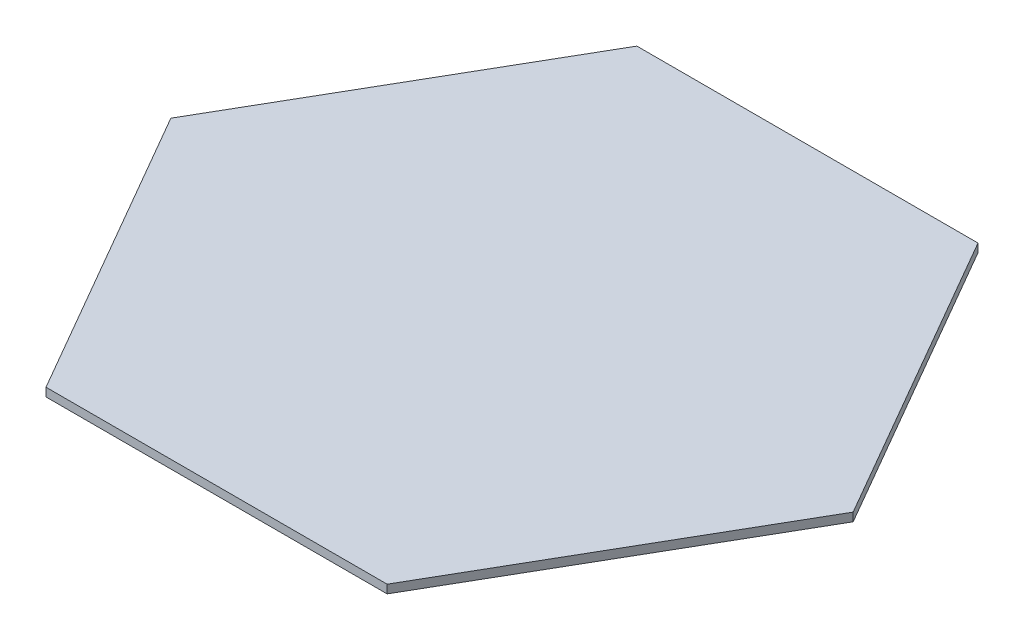
from build123d import *

# Parameters (mm, degrees)
BOSS_EXTRUDE1_DEPTH = 4


with BuildPart() as part:
    # Sketch2 → Boss-Extrude1 (new body)
    with BuildSketch(Plane(origin=(0, 0, 0), x_dir=(1, 0, 0), z_dir=(0, 1, 0))):
        Polygon((161.658075373, 0), (80.829037687, 140), (-80.829037687, 140), (-161.658075373, 0), (-80.829037687, -140), (80.829037687, -140), align=None)
    extrude(amount=BOSS_EXTRUDE1_DEPTH)


solid = part.part
